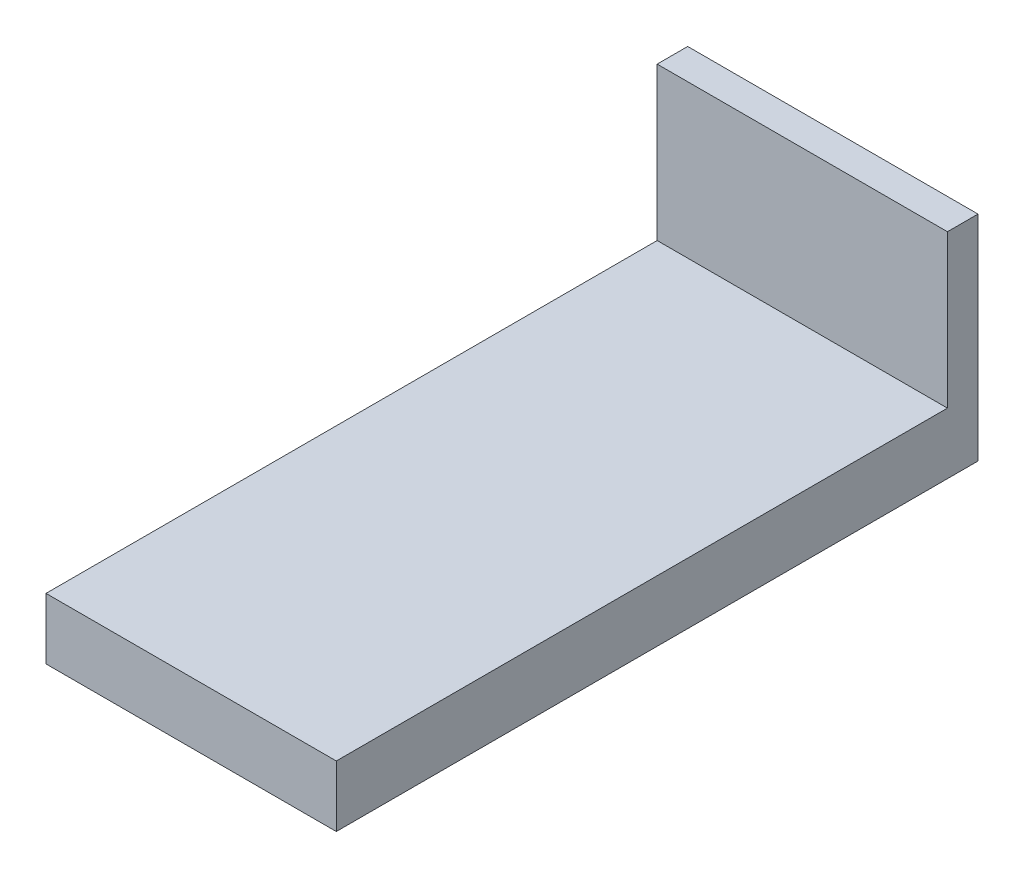
from build123d import *

# Parameters (mm, degrees)
SKETCH1_W           = 950
SKETCH1_H           = 2000
BOSS_EXTRUDE1_DEPTH = 200
SKETCH2_W           = 950
SKETCH2_H           = 100
BOSS_EXTRUDE2_DEPTH = 700


with BuildPart() as part:
    # Sketch1 → Boss-Extrude1 (new body)
    with BuildSketch(Plane(origin=(0, 0, 0), x_dir=(1, 0, 0), z_dir=(0, 1, 0))):
        Rectangle(SKETCH1_W, SKETCH1_H)
    extrude(amount=BOSS_EXTRUDE1_DEPTH)

    # Sketch2 → Boss-Extrude2 (add)
    with BuildSketch(Plane.XZ):
        with Locations((0, -1050)):
            Rectangle(SKETCH2_W, SKETCH2_H)
    extrude(amount=-BOSS_EXTRUDE2_DEPTH)


solid = part.part
